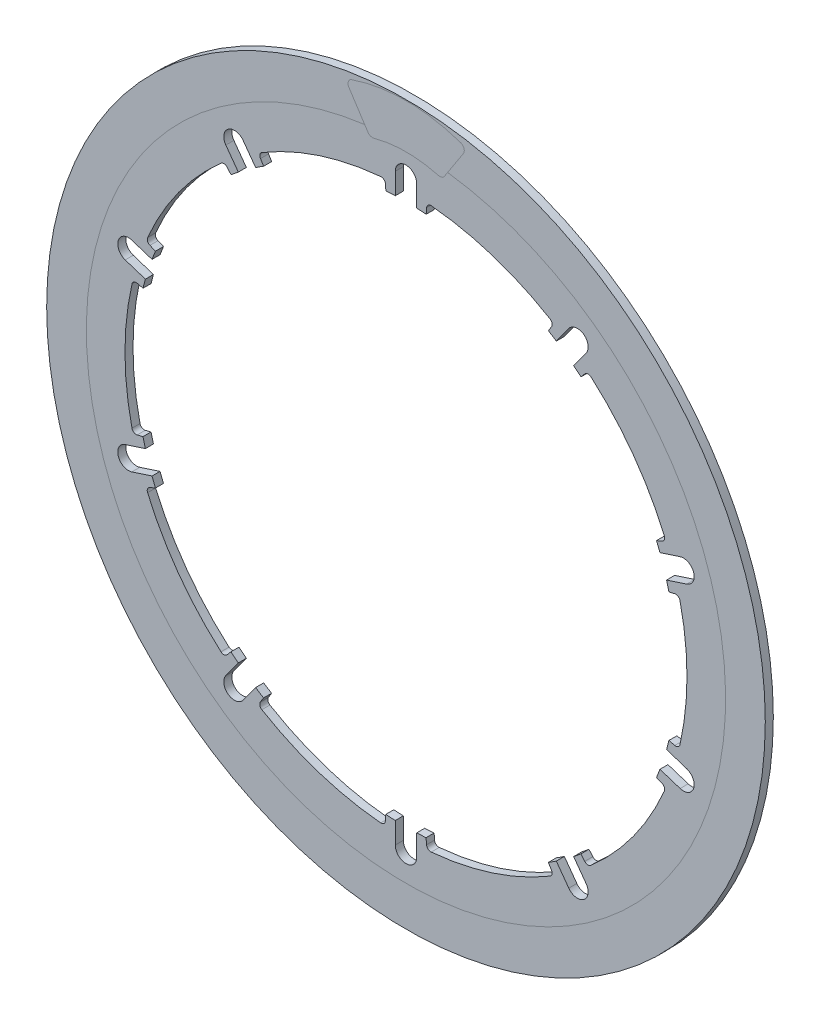
from build123d import *

# Parameters (mm, degrees)
SKETCH1_R           = 212.725
BOSS_EXTRUDE1_DEPTH = 4.7625
SKETCH8_R           = 166.37
CUT_EXTRUDE1_DEPTH  = 4.7625
CUT_EXTRUDE3_DEPTH  = 4.7625
CIRPATTERN1_COUNT   = 10
BOSS_EXTRUDE2_START = -4.7625
BOSS_EXTRUDE2_DEPTH = 4.7625
CIRPATTERN2_COUNT   = 10


with BuildPart() as part:
    # Sketch1 → Boss-Extrude1 (new body)
    with BuildSketch(Plane.XY):
        with Locations(Location((0, 0, 0), (0, 0, 180))):
            Circle(SKETCH1_R)
    extrude(amount=BOSS_EXTRUDE1_DEPTH)

    # Sketch8 → Cut-Extrude1 (cut)
    with BuildSketch(Plane(origin=(0, 0, 0), x_dir=(-1, 0, 0), z_dir=(0, 0, -1))):
        Circle(SKETCH8_R)
    extrude(amount=-CUT_EXTRUDE1_DEPTH, mode=Mode.SUBTRACT)

    # Sketch9 → Cut-Extrude3 (cut)
    with BuildSketch(Plane(origin=(0, 0, 0), x_dir=(-1, 0, 0), z_dir=(0, 0, -1))):
        with BuildLine():
            ThreePointArc((6.35, 172.72), (0, 179.07), (-6.35, 172.72))
            Line((-6.35, 172.72), (6.35, 172.72))
        make_face()
        with BuildLine():
            Line((6.35, 172.72), (-6.35, 172.72))
            ThreePointArc((-6.35, 172.72), (-4.490128088, 168.229871967), (-7.7e-08, 166.37))
            ThreePointArc((-7.7e-08, 166.37), (4.490128033, 168.229871912), (6.35, 172.72))
        make_face()
        with BuildLine():
            ThreePointArc((-7.7e-08, 166.37), (3.175578494, 166.339690397), (6.35, 166.248772627))
            Line((6.35, 166.248772627), (6.35, 172.72))
            ThreePointArc((6.35, 172.72), (4.490128033, 168.229871912), (-7.7e-08, 166.37))
        make_face()
        with BuildLine():
            Line((-6.35, 172.72), (-6.35, 166.248772627))
            ThreePointArc((-6.35, 166.248772627), (-3.175578572, 166.339690395), (-7.7e-08, 166.37))
            ThreePointArc((-7.7e-08, 166.37), (-4.490128088, 168.229871967), (-6.35, 172.72))
        make_face()
    cut_extrude3 = extrude(amount=-CUT_EXTRUDE3_DEPTH, mode=Mode.SUBTRACT)

    # CirPattern1: Cut-Extrude3 ×10 about axis
    cirpattern1_axis = Axis((0, 0, 0), (0, 0, 1))
    for i in range(1, CIRPATTERN1_COUNT):
        add(cut_extrude3.rotate(cirpattern1_axis, i * 360 / CIRPATTERN1_COUNT), mode=Mode.SUBTRACT)

    # Sketch11 → Boss-Extrude2 (add)
    with BuildSketch(Plane.XY.offset(4.7625).offset(BOSS_EXTRUDE2_START)):
        with BuildLine():
            Line((-12.157574607, 163.359431727), (-11.893810893, 159.832075437))
            ThreePointArc((-11.893810893, 159.832075437), (-9.123274415, 160.014127314), (-6.35, 160.148158204))
            Line((-6.35, 160.148158204), (-6.35, 166.248772627))
            ThreePointArc((-6.35, 166.248772627), (-10.637673325, 166.029566061), (-14.918262729, 165.699795827))
            ThreePointArc((-14.918262729, 165.699795827), (-13.048012002, 165.107506557), (-12.157574607, 163.359431727))
        make_face()
        with BuildLine():
            ThreePointArc((14.986366689, 165.693650191), (10.671793481, 166.027376429), (6.35, 166.248772627))
            Line((6.35, 166.248772627), (6.35, 160.148158204))
            ThreePointArc((6.35, 160.148158204), (9.156780546, 160.012213428), (11.960746269, 159.827080386))
            Line((11.960746269, 159.827080386), (12.224649917, 163.353528381))
            ThreePointArc((12.224649917, 163.353528381), (13.1155312, 165.101840374), (14.986366689, 165.693650191))
        make_face()
    boss_extrude2 = extrude(amount=BOSS_EXTRUDE2_DEPTH)

    # CirPattern2: Boss-Extrude2 ×10 about axis
    cirpattern2_axis = Axis((0, 0, 0), (0, 0, 1))
    for i in range(1, CIRPATTERN2_COUNT):
        add(boss_extrude2.rotate(cirpattern2_axis, i * 360 / CIRPATTERN2_COUNT))


solid = part.part
